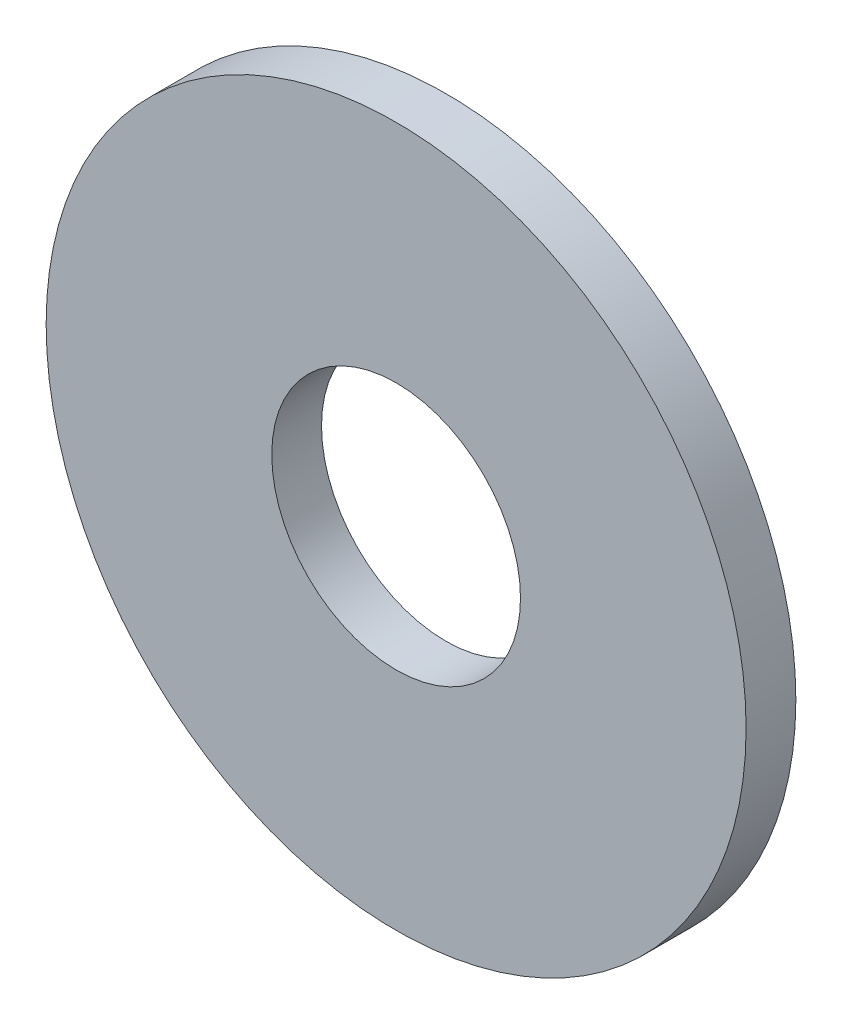
from build123d import *

# Parameters (mm, degrees)
SKETCH1_R           = 17.8689
SKETCH1_R_2         = 6.35
BOSS_EXTRUDE1_DEPTH = 2.54


with BuildPart() as part:
    # Sketch1 → Boss-Extrude1 (new body)
    with BuildSketch(Plane.XY):
        Circle(SKETCH1_R)
        Circle(SKETCH1_R_2, mode=Mode.SUBTRACT)
    extrude(amount=BOSS_EXTRUDE1_DEPTH)


solid = part.part
